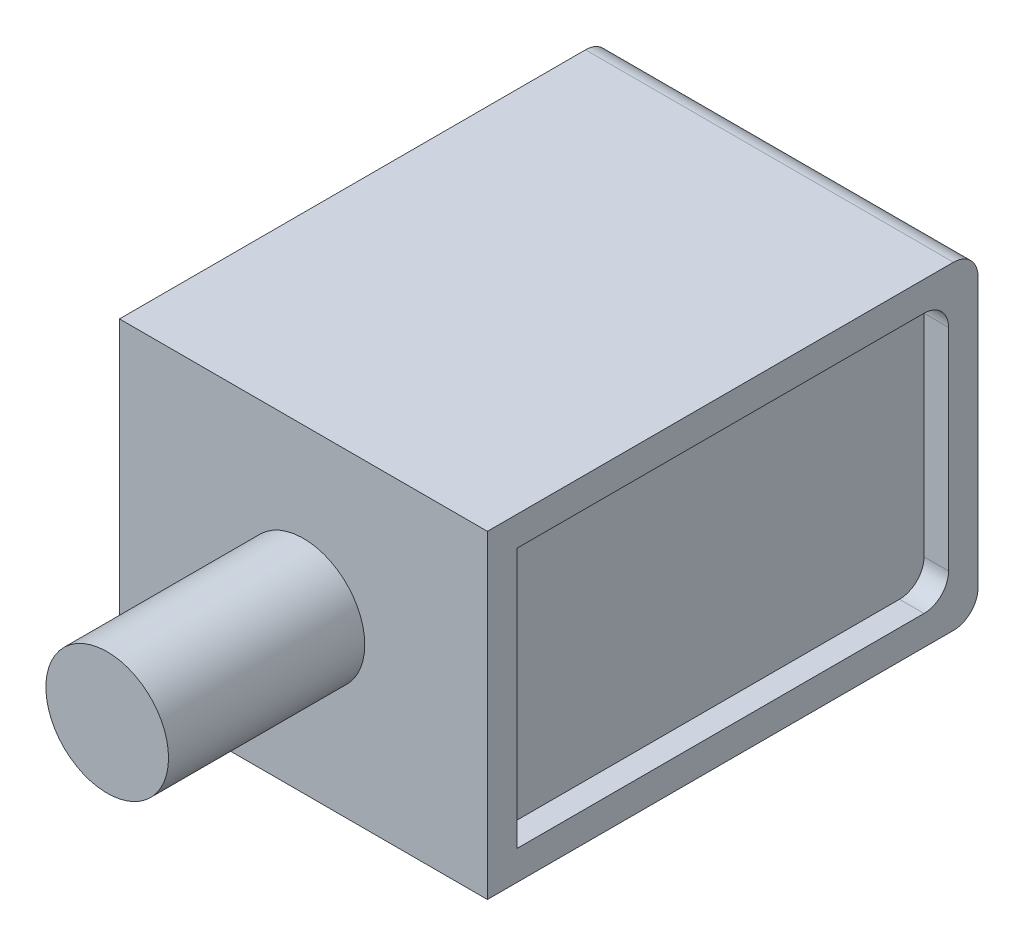
from build123d import *

# Parameters (mm, degrees)
ESQUISSE1_W             = 15
ESQUISSE1_H             = 13
BOSS_EXTRU_1_DEPTH      = 10
CONG_1_R                = 1
ESQUISSE2_W             = 17.6
ESQUISSE2_H             = 10.6
ENL_V_MAT_EXTRU_1_DEPTH = 1
CONG_2_R                = 1
CONG_2_OF_SYM_TRIE1_R   = 1
ESQUISSE3_R             = 2.5
BOSS_EXTRU_2_DEPTH      = 8


with BuildPart() as part:
    # Esquisse1 → Boss.-Extru.1 (new, symmetric)
    with BuildSketch(Plane.XY):
        Rectangle(ESQUISSE1_W, ESQUISSE1_H)
    extrude(amount=BOSS_EXTRU_1_DEPTH, both=True)

    # Congé1
    cong_1_edges = [part.edges().sort_by_distance(p)[0] for p in [
        (0, 6.5, -10),
        (0, -6.5, -10),
    ]]
    fillet(cong_1_edges, radius=CONG_1_R)

    # Esquisse2 → Enlèv. mat.-Extru.1 (cut)
    with BuildSketch(Plane(origin=(7.5, 0, 0), x_dir=(0, 0, -1), z_dir=(1, 0, 0))):
        Rectangle(ESQUISSE2_W, ESQUISSE2_H)
    enl_v_mat_extru_1 = extrude(amount=-ENL_V_MAT_EXTRU_1_DEPTH, mode=Mode.SUBTRACT)

    # Congé2
    cong_2_edges = [part.edges().sort_by_distance(p)[0] for p in [
        (7, 5.3, -8.8),
        (7, -5.3, -8.8),
    ]]
    fillet(cong_2_edges, radius=CONG_2_R)

    # Symétrie1: Enlèv. mat.-Extru.1 across plane
    add(enl_v_mat_extru_1.mirror(Plane(origin=(0, 0, 0), x_dir=(0, 0, 1), z_dir=(1, 0, 0))), mode=Mode.SUBTRACT)

    # Congé2 of Symétrie1
    cong_2_of_sym_trie1_edges = [part.edges().sort_by_distance(p)[0] for p in [
        (-7, 5.3, -8.8),
        (-7, -5.3, -8.8),
    ]]
    fillet(cong_2_of_sym_trie1_edges, radius=CONG_2_OF_SYM_TRIE1_R)

    # Esquisse3 → Boss.-Extru.2 (add)
    with BuildSketch(Plane.XY.offset(10)):
        Circle(ESQUISSE3_R)
    extrude(amount=BOSS_EXTRU_2_DEPTH)


solid = part.part
